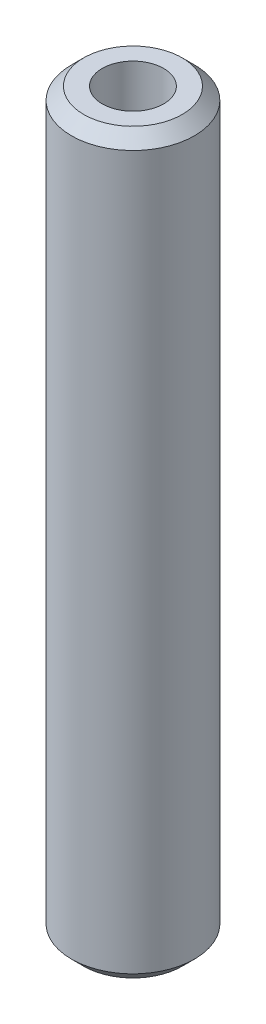
from build123d import *

# Parameters (mm, degrees)
SKETCH1_R                 = 2.5
BOSS_EXTRUDE1_DEPTH       = 30
M3X0_5_TAPPED_HOLE1_D     = 2.5
M3X0_5_TAPPED_HOLE1_DEPTH = 7
M3X0_5_TAPPED_HOLE1_TIP   = 0.751075774
M3X0_5_TAPPED_HOLE2_D     = 2.5
M3X0_5_TAPPED_HOLE2_DEPTH = 7
M3X0_5_TAPPED_HOLE2_TIP   = 0.751075774
CHAMFER1_SIZE             = 0.5


with BuildPart() as part:
    # Sketch1 → Boss-Extrude1 (new body)
    with BuildSketch(Plane(origin=(0, 0, 0), x_dir=(1, 0, 0), z_dir=(0, 1, 0))):
        with Locations(Location((0, 0, 0), (0, 0, 270))):
            Circle(SKETCH1_R)
    extrude(amount=BOSS_EXTRUDE1_DEPTH)

    # M3x0.5 Tapped Hole1
    with Locations(Plane(origin=(0, 30, 0), x_dir=(1, 0, 0), z_dir=(0, 1, 0))):
        with Locations((0, 0)):
            Hole(M3X0_5_TAPPED_HOLE1_D / 2, depth=M3X0_5_TAPPED_HOLE1_DEPTH)
            with Locations((0, 0, -(M3X0_5_TAPPED_HOLE1_DEPTH + M3X0_5_TAPPED_HOLE1_TIP / 2))):  # 118° drill point
                Cone(0, M3X0_5_TAPPED_HOLE1_D / 2, M3X0_5_TAPPED_HOLE1_TIP, mode=Mode.SUBTRACT)

    # M3x0.5 Tapped Hole2
    with Locations(Plane(origin=(0, 0, 0), x_dir=(-1, 0, 0), z_dir=(0, -1, 0))):
        with Locations((0, 0)):
            Hole(M3X0_5_TAPPED_HOLE2_D / 2, depth=M3X0_5_TAPPED_HOLE2_DEPTH)
            with Locations((0, 0, -(M3X0_5_TAPPED_HOLE2_DEPTH + M3X0_5_TAPPED_HOLE2_TIP / 2))):  # 118° drill point
                Cone(0, M3X0_5_TAPPED_HOLE2_D / 2, M3X0_5_TAPPED_HOLE2_TIP, mode=Mode.SUBTRACT)

    # Chamfer1
    chamfer1_edges = [part.edges().sort_by_distance(p)[0] for p in [
        (0, 0, -2.5),
        (0, 30, -2.5),
    ]]
    chamfer(chamfer1_edges, length=CHAMFER1_SIZE)


solid = part.part
